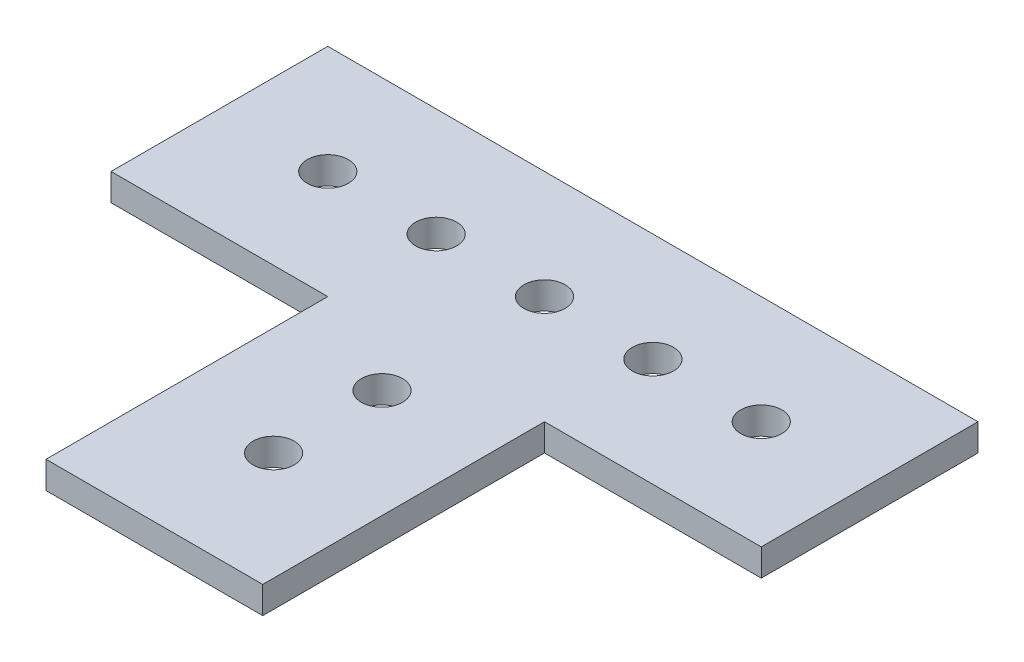
from build123d import *

# Parameters (mm, degrees)
BOSS_EXTRUDE1_DEPTH = 3.175
SKETCH3_R           = 2.413
CUT_EXTRUDE1_DEPTH  = 78.483011202


with BuildPart() as part:
    # Sketch2 → Boss-Extrude1 (new body)
    with BuildSketch(Plane(origin=(0, 0, 0), x_dir=(1, 0, 0), z_dir=(0, 1, 0))):
        Polygon((25.4, 33.02), (50.8, 33.02), (50.8, 58.42), (-25.4, 58.42), (-25.4, 33.02), (0, 33.02), (0, 0), (25.4, 0), align=None)
    extrude(amount=BOSS_EXTRUDE1_DEPTH)

    # Sketch3 → Cut-Extrude1 (cut, through all)
    with BuildSketch(Plane(origin=(0, 3.175, 0), x_dir=(1, 0, 0), z_dir=(0, 1, 0))):
        with Locations(Location((12.7, 13.97, 0), (0, 0, 270))):
            Circle(SKETCH3_R)
        with Locations(Location((-12.7, 45.72, 0), (0, 0, 270))):
            Circle(SKETCH3_R)
        with Locations(Location((12.7, 26.67, 0), (0, 0, 270))):
            Circle(SKETCH3_R)
        with Locations(Location((0, 45.72, 0), (0, 0, 270))):
            Circle(SKETCH3_R)
        with Locations(Location((12.7, 45.72, 0), (0, 0, 270))):
            Circle(SKETCH3_R)
        with Locations(Location((25.4, 45.72, 0), (0, 0, 270))):
            Circle(SKETCH3_R)
        with Locations(Location((38.1, 45.72, 0), (0, 0, 270))):
            Circle(SKETCH3_R)
    extrude(amount=-CUT_EXTRUDE1_DEPTH, mode=Mode.SUBTRACT)


solid = part.part
